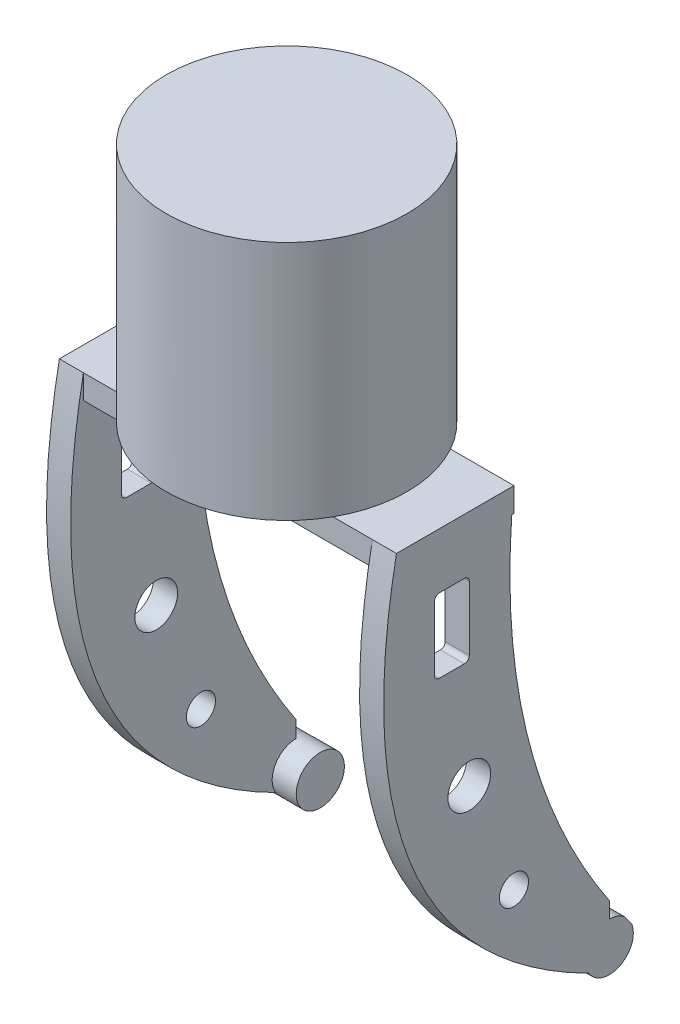
from build123d import *
from build123d.topology import SkipClean

# Parameters (mm, degrees)
SKETCH1_R           = 2.253608868
SKETCH1_R_2         = 1.535947569
BOSS_EXTRUDE1_DEPTH = 2.54
BOSS_EXTRUDE2_START = 2.54
SKETCH2_R           = 2.54
BOSS_EXTRUDE2_DEPTH = 2.54
SKETCH3_W           = 35.56
SKETCH3_H           = 12.390840881
BOSS_EXTRUDE3_DEPTH = 2.54
SKETCH4_R           = 12.7
BOSS_EXTRUDE4_DEPTH = 25.4


with BuildPart() as part:
    # Sketch1 → Boss-Extrude1 (new body)
    with BuildSketch(Plane(origin=(0, 0, 0), x_dir=(0, 0, -1), z_dir=(1, 0, 0))):
        with BuildLine():
            ThreePointArc((1.592468268, 1.978798831), (0.844230706, 2.395594815), (0, 2.54))
            Line((0, 2.54), (0, 4.244163865))
            add(Edge.make_bspline(
                [(0, 4.244163865), (-12.597388044, 22.987058756), (-10.054393134, 47.171038997)],
                knots=[0.08126898, 0.08126898, 0.08126898, 1, 1, 1], degree=2))
            Line((-10.054393134, 47.171038997), (-22.445234015, 47.171038997))
            add(Edge.make_bspline(
                [(-2.172846137, -1.315423759), (-29.204965898, 12.296498459), (-22.445234015, 47.171038997)],
                knots=[0, 0, 0, 1, 1, 1], degree=2))
            ThreePointArc((-2.172846137, -1.315423759), (1.146442405, -2.266554613), (2.347146338, 0.970826488))
            add(Edge.make_bspline(
                [(2.347146338, 0.970826488), (1.964088335, 1.472757402), (1.592468268, 1.978798831)],
                knots=[0, 0, 0, 0.025251884, 0.025251884, 0.025251884], degree=2))
        make_face()
        with Locations((-14.766403047, 22.09885284)):
            Circle(SKETCH1_R, mode=Mode.SUBTRACT)
        with Locations((-10.054393134, 10.254408813)):
            Circle(SKETCH1_R_2, mode=Mode.SUBTRACT)
        with BuildLine():
            ThreePointArc((-18.431438628, 40.801963274), (-18.282648873, 41.161173519), (-17.923438628, 41.309963274))
            Line((-17.923438628, 41.309963274), (-15.274403047, 41.309963274))
            ThreePointArc((-15.274403047, 41.309963274), (-14.915192802, 41.161173519), (-14.766403047, 40.801963274))
            Line((-14.766403047, 40.801963274), (-14.766403047, 34.017963549))
            ThreePointArc((-14.766403047, 34.017963549), (-14.915192802, 33.658753304), (-15.274403047, 33.509963549))
            Line((-15.274403047, 33.509963549), (-17.923438628, 33.509963549))
            ThreePointArc((-17.923438628, 33.509963549), (-18.282648873, 33.658753304), (-18.431438628, 34.017963549))
            Line((-18.431438628, 34.017963549), (-18.431438628, 40.801963274))
        make_face(mode=Mode.SUBTRACT)
    extrude(amount=BOSS_EXTRUDE1_DEPTH)

    # Sketch2 → Boss-Extrude2 (add)
    with SkipClean():  # the faces are left unmerged after this step: merging them gives an invalid solid
        with BuildSketch(Plane.ZY.offset(BOSS_EXTRUDE2_START)):
            Circle(SKETCH2_R)
        extrude(amount=-BOSS_EXTRUDE2_DEPTH)


with BuildPart() as body_2:
    # Mirror2: mirrored copy
    add(part.part.mirror(Plane.ZY.offset(15.24)))


with BuildPart() as part_1:
    with SkipClean():  # the faces are left unmerged after this step: merging them gives an invalid solid
        add(part.part)

        add(body_2.part)  # Boss-Extrude3 merges body 2
        # Sketch3 → Boss-Extrude3 (add)
        with BuildSketch(Plane(origin=(0, 47.171038997, 0), x_dir=(1, 0, 0), z_dir=(0, 1, 0))):
            with Locations((-15.24, -16.249813575)):
                Rectangle(SKETCH3_W, SKETCH3_H)
        extrude(amount=-BOSS_EXTRUDE3_DEPTH)

    # Sketch4 → Boss-Extrude4 (add)
    with SkipClean():  # the faces are left unmerged after this step: merging them gives an invalid solid
        with BuildSketch(Plane(origin=(0, 47.171038997, 0), x_dir=(1, 0, 0), z_dir=(0, 1, 0))):
            with Locations(Location((-15.24, -16.249813574, 0), (0, 0, 29.197947033))):
                Circle(SKETCH4_R)
        extrude(amount=BOSS_EXTRUDE4_DEPTH)


solid = part_1.part
